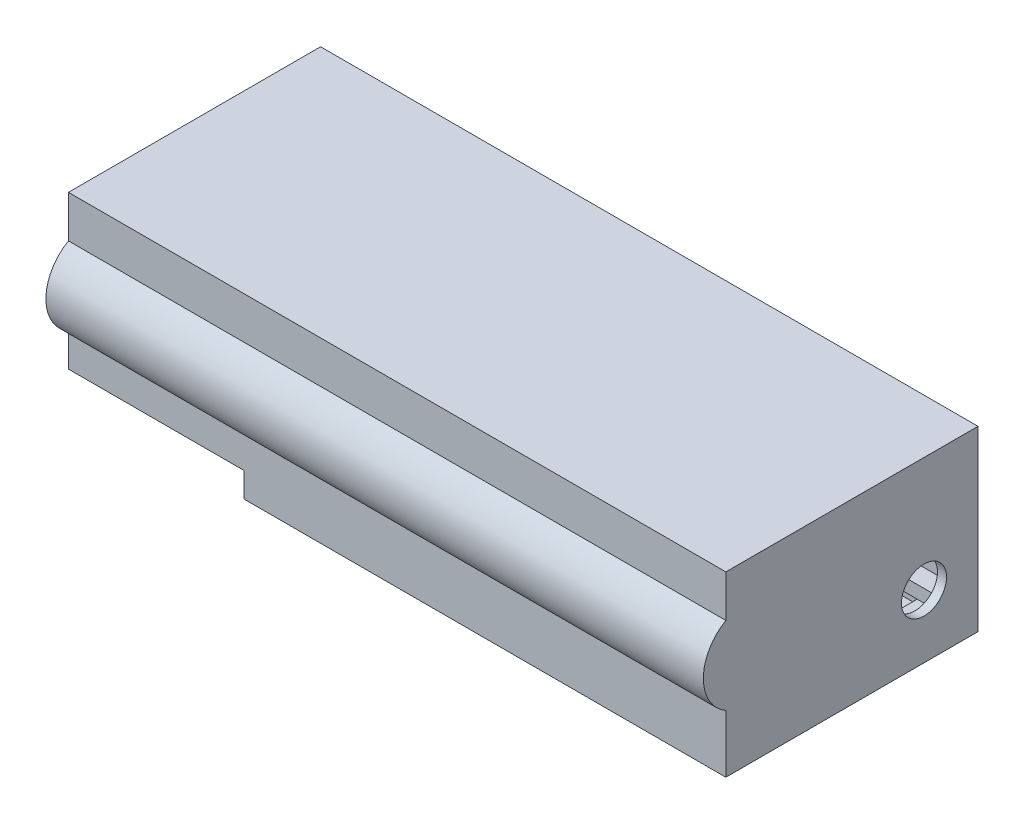
from build123d import *

# Parameters (mm, degrees)
BOSS_EXTRUDE1_DEPTH     = 144
SKETCH2_W               = 4
SKETCH2_H               = 29.171572875
CUT_EXTRUDE1_DEPTH      = 152.921854912
BOSS_EXTRUDE2_DEPTH     = 144
CUT_EXTRUDE2_DEPTH      = 153.922365925
CUT_EXTRUDE2_DEPTH_BACK = 153.922365925
CUT_EXTRUDE3_DEPTH      = 162.298636076
CUT_EXTRUDE3_DEPTH_BACK = 162.298636076
SKETCH6_W               = 39
SKETCH6_H               = 5.5
BOSS_EXTRUDE3_DEPTH     = 56
BOSS_EXTRUDE5_START     = 3
BOSS_EXTRUDE5_DEPTH     = 3
CUT_EXTRUDE5_DEPTH      = 1
CUT_EXTRUDE6_DEPTH      = 155.807138078
CUT_EXTRUDE6_DEPTH_BACK = 155.807138078
SKETCH16_R              = 5
SKETCH17_W              = 82
SKETCH17_H              = 50
CUT_EXTRUDE7_DEPTH      = 3


with BuildPart() as part:
    # Sketch1 → Boss-Extrude1 (new body)
    with BuildSketch(Plane(origin=(0, 0, 0), x_dir=(0, 0, -1), z_dir=(1, 0, 0))):
        Polygon((0, 39.5), (28, 39.5), (28, 0), (22, 0), (22, 1.5), (25, 1.5), (25, 5.5), (22, 5.5), (22, 37.5), (0, 37.5), align=None)
    boss_extrude1 = extrude(amount=BOSS_EXTRUDE1_DEPTH)

    # Mirror1: Boss-Extrude1 across plane
    add(boss_extrude1.mirror(Plane.XY))

    # Sketch2 → Cut-Extrude1 (cut, symmetric)
    with BuildSketch(Plane(origin=(144, 0, 0), x_dir=(0, 0, -1), z_dir=(1, 0, 0))):
        with Locations((24, 22.914213563)):
            Rectangle(SKETCH2_W, SKETCH2_H)
    cut_extrude1 = extrude(amount=CUT_EXTRUDE1_DEPTH, both=True, mode=Mode.SUBTRACT)

    # Mirror2: Cut-Extrude1 across plane
    add(cut_extrude1.mirror(Plane.XY), mode=Mode.SUBTRACT)

    # Sketch3 → Boss-Extrude2 (add)
    with BuildSketch(Plane(origin=(144, 0, 0), x_dir=(0, 0, -1), z_dir=(1, 0, 0))):
        with BuildLine():
            Line((-28, 30.160254038), (-28, 12.839745962))
            ThreePointArc((-28, 12.839745962), (-33, 21.5), (-28, 30.160254038))
        make_face()
    extrude(amount=-BOSS_EXTRUDE2_DEPTH)

    # Sketch4 → Cut-Extrude2 (cut, two sides: drawn at the far end of the back side and taken through both)
    with BuildSketch(Plane(origin=(144, 0, 0), x_dir=(0, 0, -1), z_dir=(1, 0, 0)).offset(-CUT_EXTRUDE2_DEPTH_BACK)):
        with BuildLine():
            Line((-26, 28.036631057), (-26, 14.620223192))
            ThreePointArc((-26, 14.620223192), (-31, 21.328427125), (-26, 28.036631057))
        make_face()
    extrude(amount=CUT_EXTRUDE2_DEPTH + CUT_EXTRUDE2_DEPTH_BACK, mode=Mode.SUBTRACT)

    # Sketch6 → Cut-Extrude3 (cut, two sides: drawn at the far end of the back side and taken through both)
    with BuildSketch(Plane(origin=(0, 0, -28), x_dir=(-1, 0, 0), z_dir=(0, 0, -1)).offset(-CUT_EXTRUDE3_DEPTH_BACK)):
        with Locations((-19.5, 2.75)):
            Rectangle(SKETCH6_W, SKETCH6_H)
    extrude(amount=CUT_EXTRUDE3_DEPTH + CUT_EXTRUDE3_DEPTH_BACK, mode=Mode.SUBTRACT)

    # Sketch7 → Boss-Extrude3 (add)
    with BuildSketch(Plane(origin=(0, 0, -28), x_dir=(-1, 0, 0), z_dir=(0, 0, -1))):
        Polygon((-144, 39.5), (-146, 39.5), (-146, 0), (-136, 0), (-136, 2.997720077), (-144, 2.997720077), align=None)
    extrude(amount=-BOSS_EXTRUDE3_DEPTH)

    # Sketch10 → Boss-Extrude5 (add)
    with BuildSketch(Plane(origin=(144, 0, 0), x_dir=(0, 0, -1), z_dir=(1, 0, 0)).offset(BOSS_EXTRUDE5_START)):
        with BuildLine():
            Line((-28, 30.160254038), (-28, 12.839745962))
            ThreePointArc((-28, 12.839745962), (-33, 21.5), (-28, 30.160254038))
        make_face()
    extrude(amount=-BOSS_EXTRUDE5_DEPTH)

    # Sketch15 → Cut-Extrude5 (cut)
    with BuildSketch(Plane(origin=(147, 0, 0), x_dir=(0, 0, -1), z_dir=(1, 0, 0))):
        with BuildLine():
            Line((-28, 12.839745962), (-28, 30.160254038))
            ThreePointArc((-28, 30.160254038), (-33, 21.5), (-28, 12.839745962))
        make_face()
    extrude(amount=-CUT_EXTRUDE5_DEPTH, mode=Mode.SUBTRACT)

    # Sketch16 → Cut-Extrude6 (cut, two sides: drawn at the far end of the back side and taken through both)
    with BuildSketch(Plane(origin=(146, 0, 0), x_dir=(0, 0, -1), z_dir=(1, 0, 0)).offset(-CUT_EXTRUDE6_DEPTH_BACK)):
        with Locations((16, 14)):
            Circle(SKETCH16_R)
    extrude(amount=CUT_EXTRUDE6_DEPTH + CUT_EXTRUDE6_DEPTH_BACK, mode=Mode.SUBTRACT)

    # Sketch17 → Cut-Extrude7 (cut)
    with BuildSketch(Plane.XZ):
        with Locations((80, 0)):
            Rectangle(SKETCH17_W, SKETCH17_H)
    extrude(amount=-CUT_EXTRUDE7_DEPTH, mode=Mode.SUBTRACT)


solid = part.part
